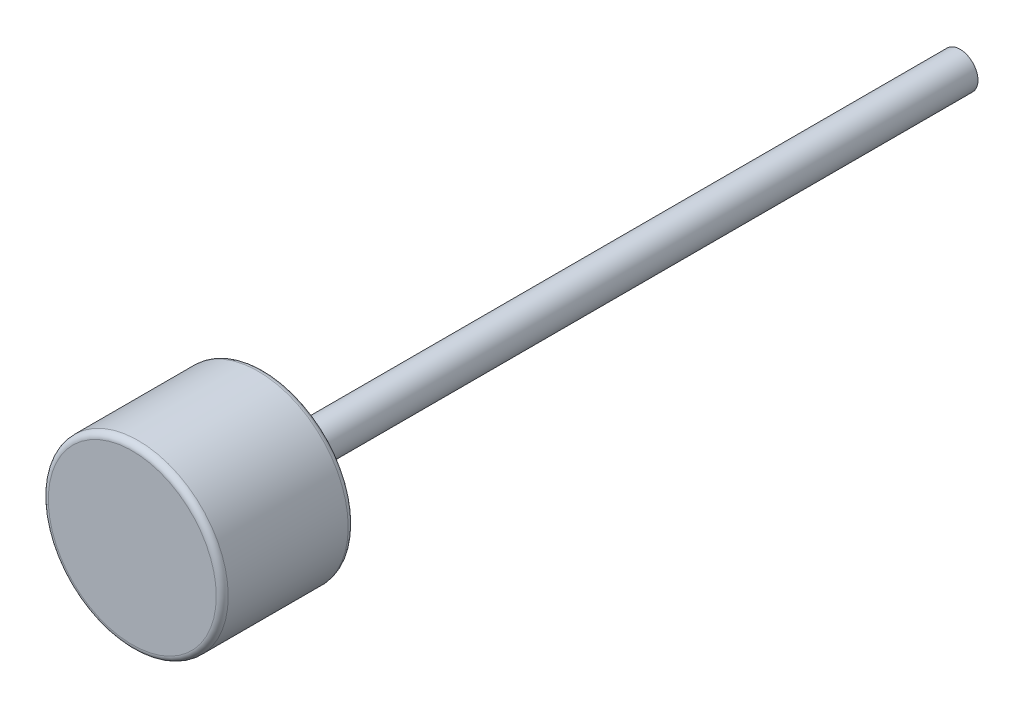
from build123d import *

# Parameters (mm, degrees)
SKETCH_1_R      = 7.5
EXTRUDE_1_DEPTH = 11
FILLET_1_R      = 0.5
SKETCH_2_R      = 1.5
EXTRUDE_2_DEPTH = 58


with BuildPart() as part:
    # 草图1 → 凸台-拉伸1 (new body)
    with BuildSketch(Plane.XY):
        Circle(SKETCH_1_R)
    extrude(amount=EXTRUDE_1_DEPTH)

    # 圆角1
    fillet_1_edges = [part.edges().sort_by_distance(p)[0] for p in [
        (-7.5, 0, 0),
        (-7.5, 0, 11),
    ]]
    fillet(fillet_1_edges, radius=FILLET_1_R)

    # 草图2 → 凸台-拉伸2 (add)
    with BuildSketch(Plane(origin=(0, 0, 0), x_dir=(-1, 0, 0), z_dir=(0, 0, -1))):
        with Locations(Location((0, 0, 0), (0, 0, 180))):
            Circle(SKETCH_2_R)
    extrude(amount=EXTRUDE_2_DEPTH)


solid = part.part
